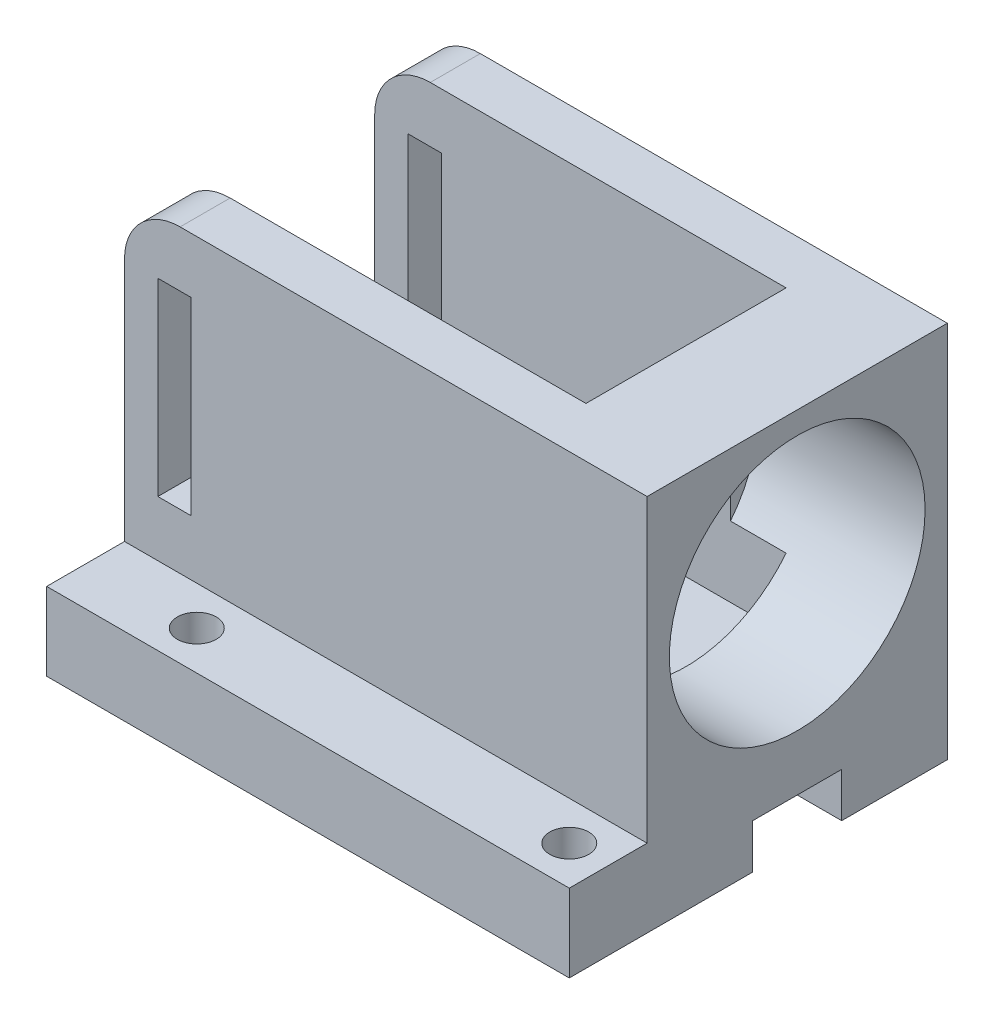
from build123d import *

# Parameters (mm, degrees)
SKETCH_1_W          = 47
SKETCH_1_H          = 34
EXTRUDE_1_DEPTH     = 7
CUT_EXTRUDE_1_DEPTH = 51.46781152378217
HOLE_WIZARD_1_D     = 3.5
EXTRUDE_2_DEPTH     = 27
HOLE_WIZARD_2_D     = 23
HOLE_WIZARD_2_DEPTH = 10
CUT_EXTRUDE_2_DEPTH = 54.04714883949938
CUT_EXTRUDE_START   = -5
SKETCH_11_R         = 11.50000000000001
CUT_EXTRUDE_3_DEPTH = 5
CUT_EXTRUDE_4_DEPTH = 50.36851223198853
FILLET_1_R          = 5


with BuildPart() as part:
    # 草图1 → 凸台-拉伸1 (new body)
    with BuildSketch(Plane(origin=(0, 0, 0), x_dir=(1, 0, 0), z_dir=(0, 1, 0))):
        Rectangle(SKETCH_1_W, SKETCH_1_H)
    extrude(amount=EXTRUDE_1_DEPTH)

    # 草图2 → 切除-拉伸1 (cut, through all)
    with BuildSketch(Plane(origin=(23.500000000000007, 0, 0), x_dir=(0, 0, -1), z_dir=(1, 0, 0))):
        Polygon((-0.4999999999999987, 4), (-0.4999999999999987, 0), (3.5, 0), (7.5, 0), (7.500000000000002, 4), align=None)
    extrude(amount=-CUT_EXTRUDE_1_DEPTH, mode=Mode.SUBTRACT)

    # 孔1 (through all)
    with Locations(Plane(origin=(0, 7, 0), x_dir=(1, 0, 0), z_dir=(0, 1, 0))):
        with Locations((-13.5, -13.5), (20, -13.5)):
            Hole(HOLE_WIZARD_1_D / 2)

    # 草图6 → 凸台-拉伸2 (add)
    with BuildSketch(Plane(origin=(0, 7, 0), x_dir=(1, 0, 0), z_dir=(0, 1, 0))):
        Polygon((-23.499999999999993, -10.000000000000009), (23.500000000000007, -10.000000000000002), (23.500000000000007, 17), (-23.499999999999993, 17), align=None)
    extrude(amount=EXTRUDE_2_DEPTH)

    # 孔2
    with Locations(Plane(origin=(23.500000000000007, 0, 0), x_dir=(0, 0, -1), z_dir=(1, 0, 0))):
        with Locations((3.5, 20.5)):
            Hole(HOLE_WIZARD_2_D / 2, depth=HOLE_WIZARD_2_DEPTH)

    # 草图10 → 切除-拉伸2 (cut, through all)
    with BuildSketch(Plane(origin=(13.500000000000007, 0, 0), x_dir=(0, 0, -1), z_dir=(1, 0, 0))):
        Polygon((-5.5000000000000036, 34.00000000000001), (12.499999999999998, 34.00000000000001), (12.499999999999998, 7.000000000000013), (-5.5, 7.000000000000013), align=None)
    extrude(amount=-CUT_EXTRUDE_2_DEPTH, mode=Mode.SUBTRACT)

    # 草图11 → 切除-拉伸3 (cut)
    with BuildSketch(Plane(origin=(13.500000000000007, 0, 0), x_dir=(0, 0, -1), z_dir=(1, 0, 0)).offset(CUT_EXTRUDE_START)):
        with Locations((3.500000000000003, 20.500000000000004)):
            Circle(SKETCH_11_R)
    extrude(amount=CUT_EXTRUDE_3_DEPTH, mode=Mode.SUBTRACT)

    # 草图12 → 切除-拉伸4 (cut, through all)
    with BuildSketch(Plane.XY.offset(10.000000000000005)):
        Polygon((-20.499999999999993, 29), (-17.499999999999996, 29), (-17.499999999999993, 12), (-20.49999999999999, 12), align=None)
    extrude(amount=-CUT_EXTRUDE_4_DEPTH, mode=Mode.SUBTRACT)

    # 圆角1
    fillet_1_edges = [part.edges().sort_by_distance(p)[0] for p in [
        (-23.499999999999993, 34, -14.75),
        (-23.499999999999993, 34, 7.750000000000007),
    ]]
    fillet(fillet_1_edges, radius=FILLET_1_R)


solid = part.part
